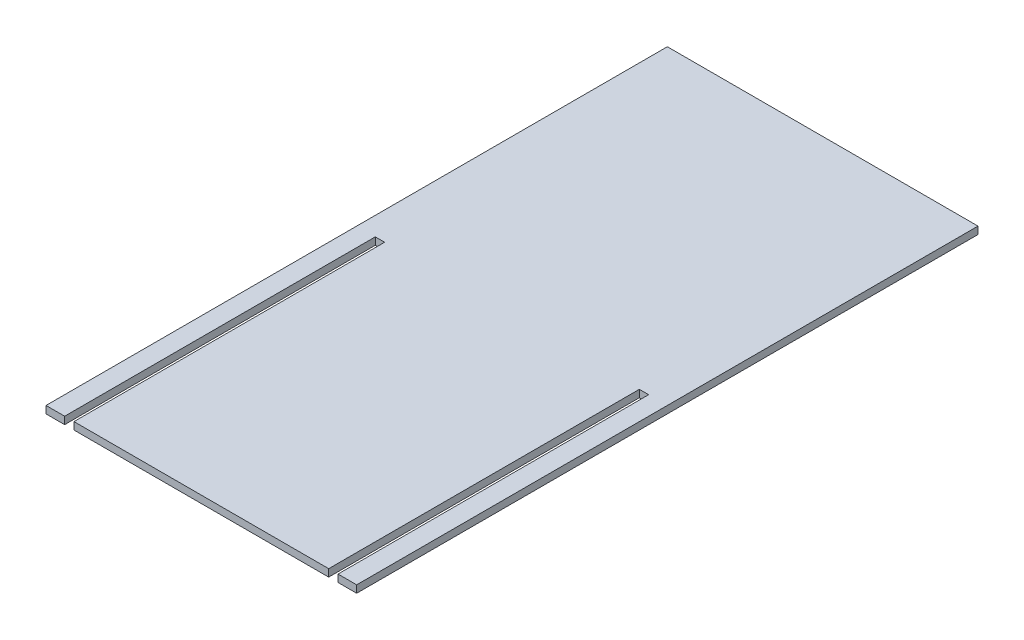
from build123d import *

# Parameters (mm, degrees)
SKETCH1_W           = 127
SKETCH1_H           = 254
BOSS_EXTRUDE1_DEPTH = 3
SKETCH2_W           = 3.81
SKETCH2_H           = 127
CUT_EXTRUDE1_DEPTH  = 284.996478851


with BuildPart() as part:
    # Sketch1 → Boss-Extrude1 (new body)
    with BuildSketch(Plane(origin=(0, 0, 0), x_dir=(1, 0, 0), z_dir=(0, 1, 0))):
        with Locations((63.5, 127)):
            Rectangle(SKETCH1_W, SKETCH1_H)
    extrude(amount=BOSS_EXTRUDE1_DEPTH)

    # Sketch2 → Cut-Extrude1 (cut, through all)
    with BuildSketch(Plane(origin=(0, 3, 0), x_dir=(1, 0, 0), z_dir=(0, 1, 0))):
        with Locations((9.525, 63.5)):
            Rectangle(SKETCH2_W, SKETCH2_H)
        with Locations((117.475, 63.5)):
            Rectangle(SKETCH2_W, SKETCH2_H)
    extrude(amount=-CUT_EXTRUDE1_DEPTH, mode=Mode.SUBTRACT)


solid = part.part
